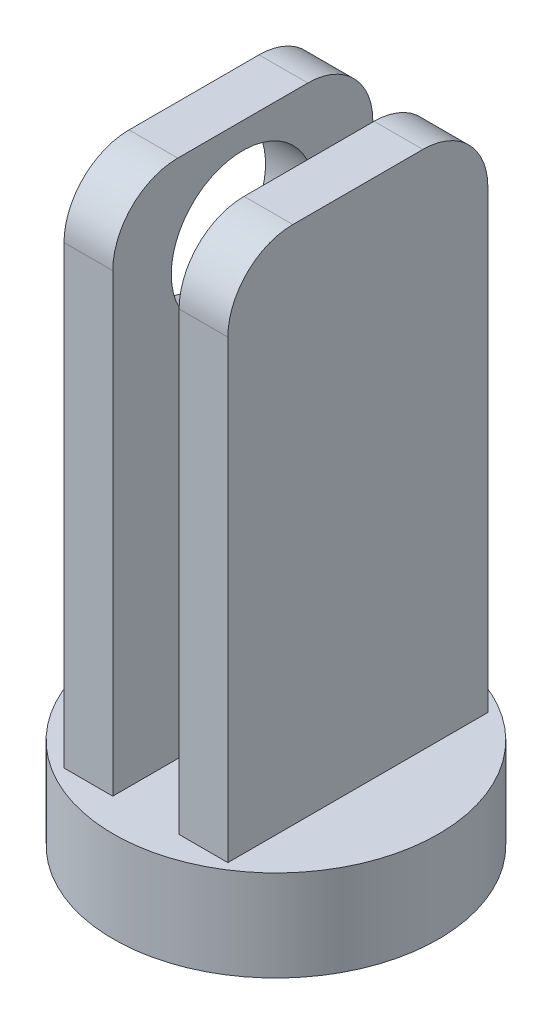
from build123d import *

# Parameters (mm, degrees)
SKETCH1_R           = 25
BOSS_EXTRUDE1_DEPTH = 14
SKETCH2_R           = 11
CUT_EXTRUDE1_DEPTH  = 7
SKETCH5_W           = 7.5
SKETCH5_H           = 40
BOSS_EXTRUDE2_DEPTH = 80
FILLET1_R           = 10
SKETCH7_R           = 11
CUT_EXTRUDE3_DEPTH  = 24.5


with BuildPart() as part:
    # Sketch1 → Boss-Extrude1 (new body)
    with BuildSketch(Plane(origin=(0, 0, 0), x_dir=(1, 0, 0), z_dir=(0, 1, 0))):
        with Locations(Location((0, 0, 0), (0, 0, 90))):
            Circle(SKETCH1_R)
    extrude(amount=BOSS_EXTRUDE1_DEPTH)

    # Sketch2 → Cut-Extrude1 (cut)
    with BuildSketch(Plane.XZ):
        with Locations(Location((0, 0, 0), (0, 0, 270))):
            Circle(SKETCH2_R)
    extrude(amount=-CUT_EXTRUDE1_DEPTH, mode=Mode.SUBTRACT)

    # Sketch5 → Boss-Extrude2 (add)
    with BuildSketch(Plane(origin=(0, 14, 0), x_dir=(1, 0, 0), z_dir=(0, 1, 0))):
        with Locations((-8.85, 0)):
            Rectangle(SKETCH5_W, SKETCH5_H)
        with Locations((8.85, 0)):
            Rectangle(SKETCH5_W, SKETCH5_H)
    extrude(amount=BOSS_EXTRUDE2_DEPTH)

    # Fillet1
    fillet1_edges = [part.edges().sort_by_distance(p)[0] for p in [
        (-8.85, 94, 20),
        (-8.85, 94, -20),
        (8.85, 94, 20),
        (8.85, 94, -20),
    ]]
    fillet(fillet1_edges, radius=FILLET1_R)

    # Sketch7 → Cut-Extrude3 (cut)
    with BuildSketch(Plane.ZY.offset(12.6)):
        with Locations((0, 79)):
            Circle(SKETCH7_R)
    extrude(amount=-CUT_EXTRUDE3_DEPTH, mode=Mode.SUBTRACT)


solid = part.part
